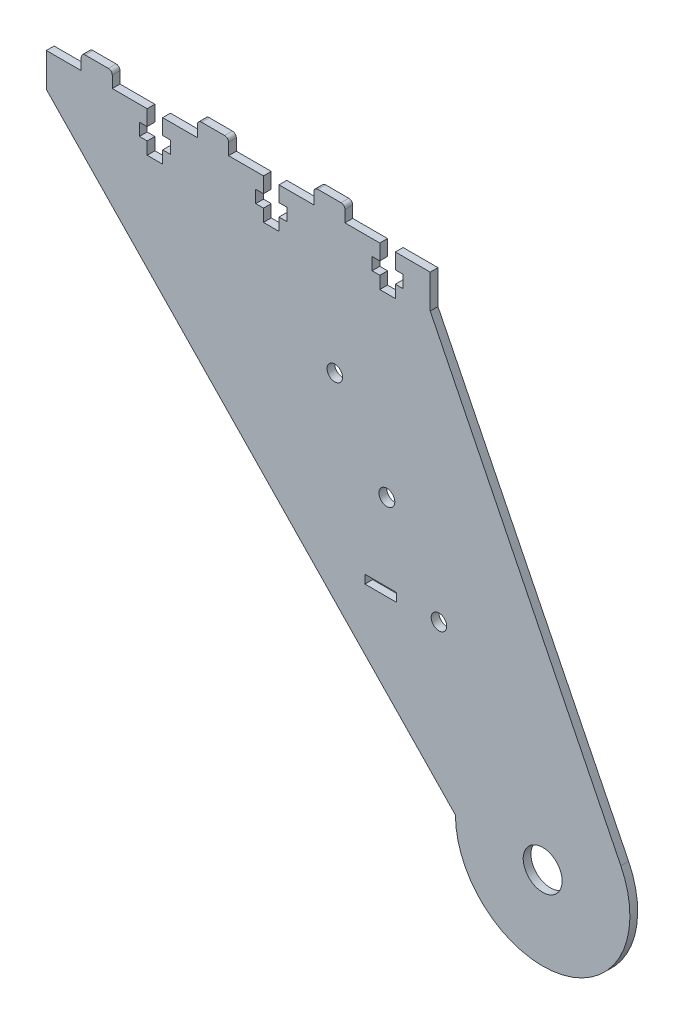
from build123d import *

# Parameters (mm, degrees)
SKETCH_1_R      = 2
SKETCH_1_R_2    = 5.02
SKETCH_1_R_3    = 2.05
SKETCH_1_W      = 8.2
SKETCH_1_H      = 2.2
EXTRUDE_1_DEPTH = 2
FILLET_1_R      = 1


with BuildPart() as part:
    # 草图1 → 凸台-拉伸1 (new body)
    with BuildSketch(Plane.XY):
        with BuildLine():
            Line((-38.15, 66.25), (-38.15, 62.25))
            Line((-38.15, 62.25), (-40.15, 62.25))
            Line((-40.15, 62.25), (-40.15, 59.05))
            Line((-40.15, 59.05), (-38.15, 59.05))
            Line((-38.15, 59.05), (-38.15, 55.85))
            Line((-38.15, 55.85), (-34.15, 55.85))
            Line((-34.15, 55.85), (-34.15, 59.05))
            Line((-34.15, 59.05), (-32.15, 59.05))
            Line((-32.15, 59.05), (-32.15, 62.25))
            Line((-32.15, 62.25), (-34.15, 62.25))
            Line((-34.15, 62.25), (-34.15, 66.25))
            Line((-34.15, 66.25), (-25.15, 66.25))
            Line((-25.15, 66.25), (-25.15, 70.25))
            Line((-25.15, 70.25), (-17.15, 70.25))
            Line((-17.15, 70.25), (-17.15, 66.25))
            Line((-17.15, 66.25), (-8.15, 66.25))
            Line((-8.15, 66.25), (-8.15, 62.25))
            Line((-8.15, 62.25), (-10.15, 62.25))
            Line((-10.15, 62.25), (-10.15, 59.05))
            Line((-10.15, 59.05), (-8.15, 59.05))
            Line((-8.15, 59.05), (-8.15, 55.85))
            Line((-8.15, 55.85), (-4.15, 55.85))
            Line((-4.15, 55.85), (-4.15, 59.05))
            Line((-4.15, 59.05), (-2.15, 59.05))
            Line((-2.15, 59.05), (-2.15, 62.25))
            Line((-2.15, 62.25), (-4.15, 62.25))
            Line((-4.15, 62.25), (-4.15, 66.25))
            Line((-4.15, 66.25), (4.85, 66.25))
            Line((4.85, 66.25), (4.85, 57.55))
            Line((4.85, 57.55), (54.01460577, -41.768082641))
            ThreePointArc((54.01460577, -41.768082641), (38.975737517, -73.658373169), (11.35, -51.75))
            Line((11.35, -51.75), (-94.15, 57.55))
            Line((-94.15, 57.55), (-94.15, 66.25))
            Line((-94.15, 66.25), (-85.15, 66.25))
            Line((-85.15, 66.25), (-85.15, 70.25))
            Line((-85.15, 70.25), (-77.15, 70.25))
            Line((-77.15, 70.25), (-77.15, 66.25))
            Line((-77.15, 66.25), (-68.15, 66.25))
            Line((-68.15, 66.25), (-68.15, 62.25))
            Line((-68.15, 62.25), (-70.15, 62.25))
            Line((-70.15, 62.25), (-70.15, 59.05))
            Line((-70.15, 59.05), (-68.15, 59.05))
            Line((-68.15, 59.05), (-68.15, 55.85))
            Line((-68.15, 55.85), (-64.15, 55.85))
            Line((-64.15, 55.85), (-64.15, 59.05))
            Line((-64.15, 59.05), (-62.15, 59.05))
            Line((-62.15, 59.05), (-62.15, 62.25))
            Line((-62.15, 62.25), (-64.15, 62.25))
            Line((-64.15, 62.25), (-64.15, 66.25))
            Line((-64.15, 66.25), (-55.15, 66.25))
            Line((-55.15, 66.25), (-55.15, 70.25))
            Line((-55.15, 70.25), (-47.15, 70.25))
            Line((-47.15, 70.25), (-47.15, 66.25))
            Line((-47.15, 66.25), (-38.15, 66.25))
        make_face()
        with Locations((-19.762745434, 31.422010331)):
            Circle(SKETCH_1_R, mode=Mode.SUBTRACT)
        with Locations((7.098407643, -10.75)):
            Circle(SKETCH_1_R, mode=Mode.SUBTRACT)
        with Locations((33.85, -52.75)):
            Circle(SKETCH_1_R_2, mode=Mode.SUBTRACT)
        with Locations((-6.332168895, 10.336005166)):
            Circle(SKETCH_1_R_3, mode=Mode.SUBTRACT)
        with Locations((-7.901592357, -10.75)):
            Rectangle(SKETCH_1_W, SKETCH_1_H, mode=Mode.SUBTRACT)
    extrude(amount=EXTRUDE_1_DEPTH)

    # 圆角1
    fillet_1_edges = [part.edges().sort_by_distance(p)[0] for p in [
        (-25.15, 70.25, 1),
        (-17.15, 70.25, 1),
        (-85.15, 70.25, 1),
        (-77.15, 70.25, 1),
        (-55.15, 70.25, 1),
        (-47.15, 70.25, 1),
    ]]
    fillet(fillet_1_edges, radius=FILLET_1_R)


solid = part.part
